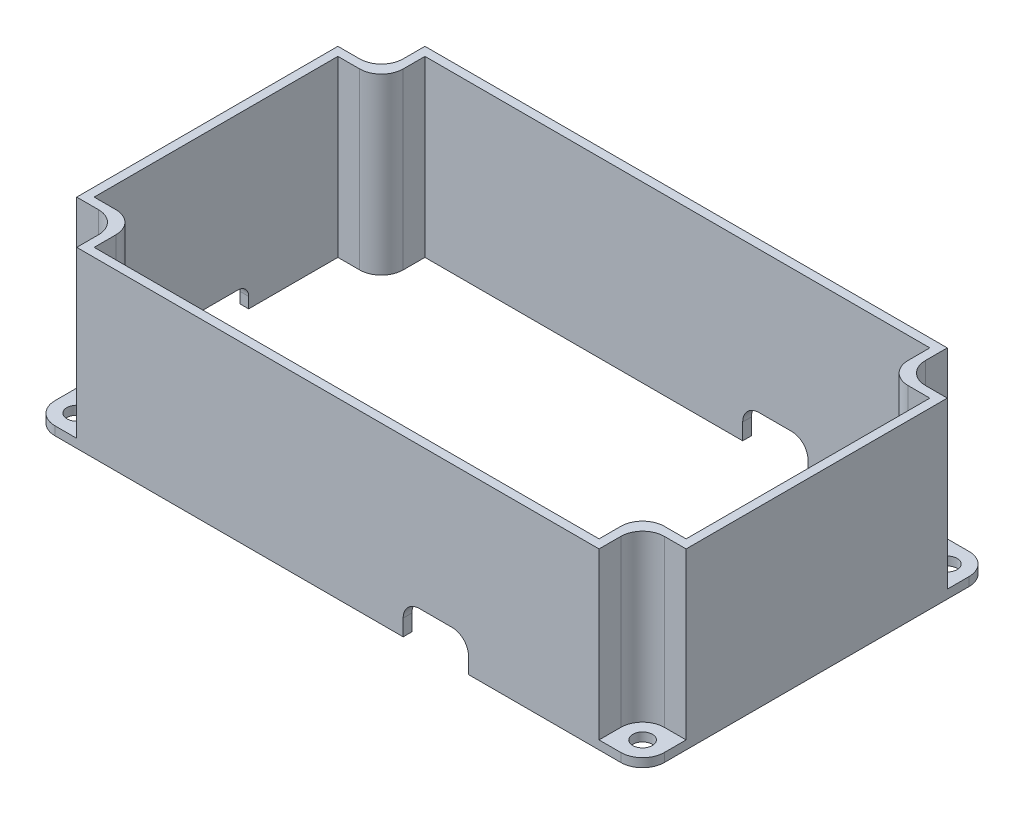
from build123d import *

# Parameters (mm, degrees)
BOSS_EXTRUDE6_DEPTH = 40
SKETCH1_7_W         = 10
SKETCH1_7_H         = 10
SKETCH1_7_R         = 2.25
BOSS_EXTRUDE7_DEPTH = 2
FILLET1_R           = 5
CUT_EXTRUDE1_DEPTH  = 114.578166916
CUT_EXTRUDE2_REACH  = 152.997


with BuildPart() as part:
    # Sketch1 → Boss-Extrude6 (new body)
    with BuildSketch(Plane(origin=(0, 0, 0), x_dir=(1, 0, 0), z_dir=(0, 1, 0))):
        Polygon((70, 30), (60, 30), (60, 40), (-60, 40), (-60, 30), (-70, 30), (-70, -30), (-60, -30), (-60, -40), (60, -40), (60, -30), (70, -30), align=None)
        Polygon((58, 28), (68, 28), (68, -28), (58, -28), (58, -38), (-58, -38), (-58, -28), (-68, -28), (-68, 28), (-58, 28), (-58, 38), (58, 38), align=None, mode=Mode.SUBTRACT)
    extrude(amount=BOSS_EXTRUDE6_DEPTH)

    # Sketch1<7> → Boss-Extrude7 (add)
    # profile 1 of 4: a face of its own
    with BuildSketch(Plane(origin=(0, 0, 0), x_dir=(1, 0, 0), z_dir=(0, 1, 0))):
        with Locations((65, 35)):
            Rectangle(SKETCH1_7_W, SKETCH1_7_H)
        with Locations((65, 35)):
            Circle(SKETCH1_7_R, mode=Mode.SUBTRACT)
    # profile 2 of 4: a face of its own
    with BuildSketch(Plane(origin=(0, 0, 0), x_dir=(1, 0, 0), z_dir=(0, 1, 0))):
        with Locations((65, -35)):
            Rectangle(SKETCH1_7_W, SKETCH1_7_H)
        with Locations((65, -35)):
            Circle(SKETCH1_7_R, mode=Mode.SUBTRACT)
    # profile 3 of 4: a face of its own
    with BuildSketch(Plane(origin=(0, 0, 0), x_dir=(1, 0, 0), z_dir=(0, 1, 0))):
        with Locations((-65, 35)):
            Rectangle(SKETCH1_7_W, SKETCH1_7_H)
        with Locations((-65, 35)):
            Circle(SKETCH1_7_R, mode=Mode.SUBTRACT)
    # profile 4 of 4: a face of its own
    with BuildSketch(Plane(origin=(0, 0, 0), x_dir=(1, 0, 0), z_dir=(0, 1, 0))):
        with Locations((-65, -35)):
            Rectangle(SKETCH1_7_W, SKETCH1_7_H)
        with Locations((-65, -35)):
            Circle(SKETCH1_7_R, mode=Mode.SUBTRACT)
    extrude(amount=BOSS_EXTRUDE7_DEPTH)

    # Fillet1
    fillet1_edges = [part.edges().sort_by_distance(p)[0] for p in [
        (-70, 1, 40),
        (-70, 1, -40),
        (70, 1, -40),
        (70, 1, 40),
        (-60, 21, 30),
        (60, 21, 30),
        (58, 20, 28),
        (58, 20, -28),
        (60, 21, -30),
        (-58, 20, 28),
        (-58, 20, -28),
        (-60, 21, -30),
    ]]
    fillet(fillet1_edges, radius=FILLET1_R)

    # Sketch2 → Cut-Extrude1 (cut, through all)
    with BuildSketch(Plane(origin=(0, 0, -40), x_dir=(-1, 0, 0), z_dir=(0, 0, -1))):
        with BuildLine():
            Line((-30, 0), (-15, 0))
            Line((-15, 0), (-15, 3.75))
            ThreePointArc((-15, 3.75), (-16.098349571, 6.401650429), (-18.75, 7.5))
            Line((-18.75, 7.5), (-26.25, 7.5))
            ThreePointArc((-26.25, 7.5), (-28.901650429, 6.401650429), (-30, 3.75))
            Line((-30, 3.75), (-30, 0))
        make_face()
    extrude(amount=-CUT_EXTRUDE1_DEPTH, mode=Mode.SUBTRACT)

    # Sketch3 → Cut-Extrude2 (cut, up to next)
    with BuildSketch(Plane.ZY.offset(70), mode=Mode.PRIVATE) as cut_extrude2_sk1:
        with BuildLine():
            Line((-7.5, 0), (7.5, 0))
            Line((7.5, 0), (7.5, 2.5))
            ThreePointArc((7.5, 2.5), (6.767766953, 4.267766953), (5, 5))
            Line((5, 5), (-5, 5))
            ThreePointArc((-5, 5), (-6.767766953, 4.267766953), (-7.5, 2.5))
            Line((-7.5, 2.5), (-7.5, 0))
        make_face()
    cut_extrude2_tool1 = extrude(cut_extrude2_sk1.sketch, amount=-CUT_EXTRUDE2_REACH, mode=Mode.PRIVATE) & part.part
    add(cut_extrude2_tool1.solids().sort_by_distance((-70, 2.42798, 0))[0], mode=Mode.SUBTRACT)


solid = part.part
